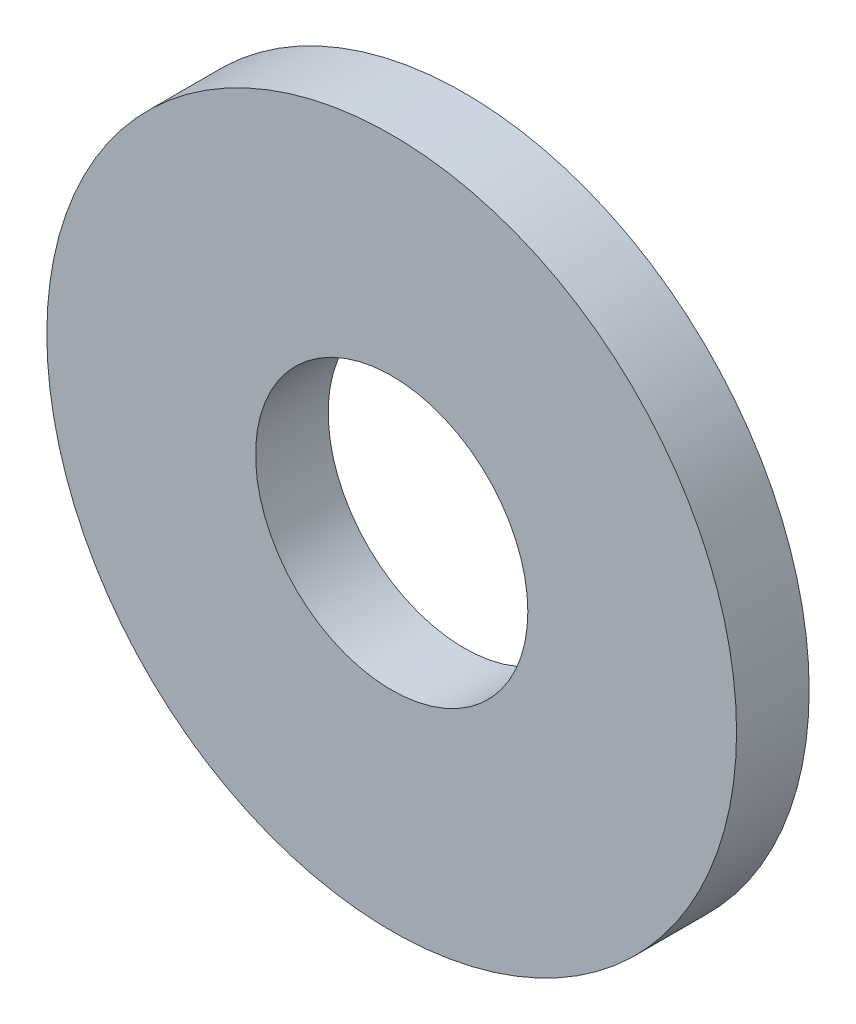
from build123d import *

# Parameters (mm, degrees)
BOSS_EXTRUDE1_DEPTH      = 0.508
BOSS_EXTRUDE1_DEPTH_BACK = 0.508
SKETCH3_R                = 4.826
SKETCH3_R_2              = 1.905


with BuildPart() as part:
    # Sketch3 → Boss-Extrude1 (new, two sides: drawn at the far end of the back side and taken through both)
    with BuildSketch(Plane.XY.offset(-BOSS_EXTRUDE1_DEPTH_BACK)):
        Circle(SKETCH3_R)
        Circle(SKETCH3_R_2, mode=Mode.SUBTRACT)
    extrude(amount=BOSS_EXTRUDE1_DEPTH + BOSS_EXTRUDE1_DEPTH_BACK)


solid = part.part
